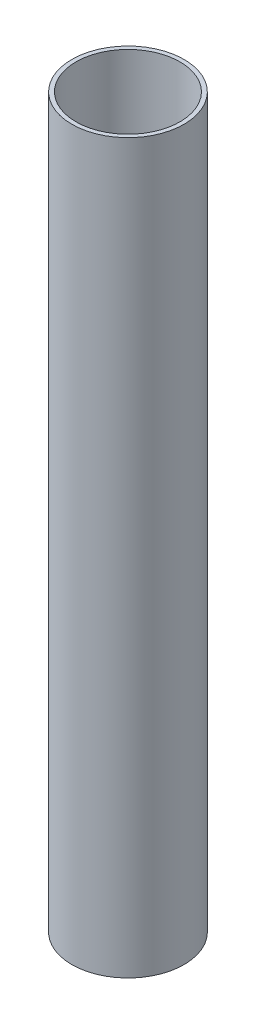
from build123d import *

# Parameters (mm, degrees)
SKETCH2_R           = 13.716
SKETCH2_R_2         = 12.7
BOSS_EXTRUDE1_DEPTH = 177.8


with BuildPart() as part:
    # Sketch2 → Boss-Extrude1 (new body)
    with BuildSketch(Plane(origin=(0, 0, 0), x_dir=(1, 0, 0), z_dir=(0, 1, 0))):
        with Locations(Location((0, 0, 0), (0, 0, 270))):
            Circle(SKETCH2_R)
        with Locations(Location((0, 0, 0), (0, 0, 270))):
            Circle(SKETCH2_R_2, mode=Mode.SUBTRACT)
    extrude(amount=BOSS_EXTRUDE1_DEPTH)


solid = part.part
